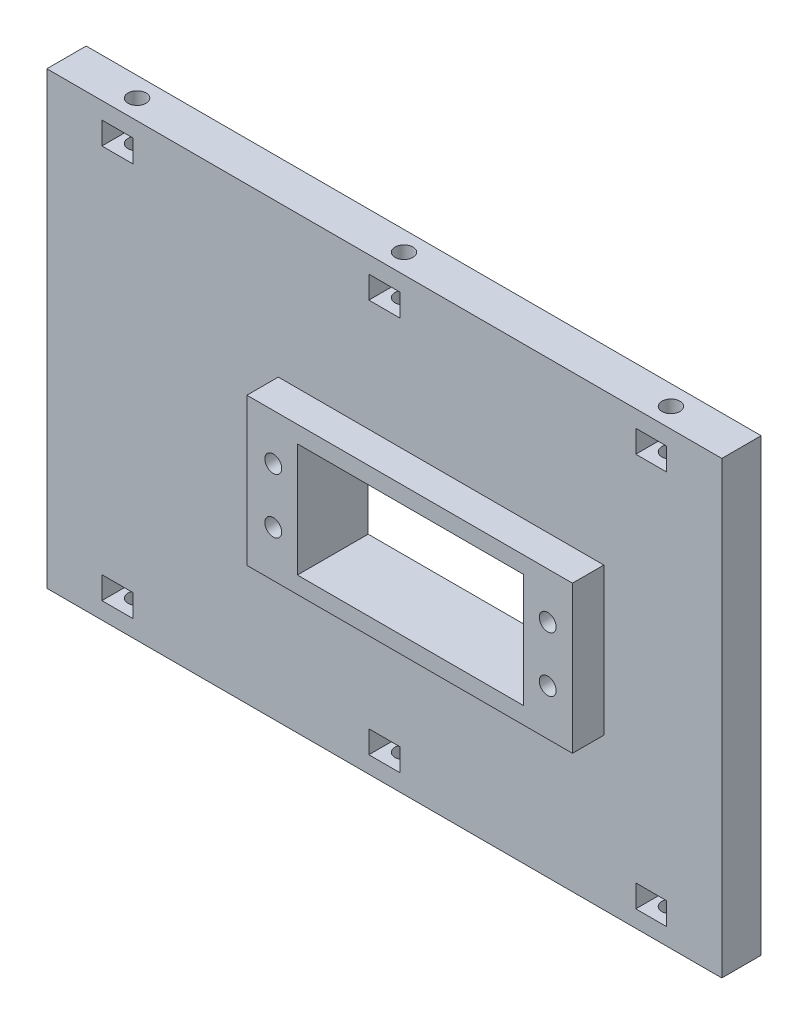
from build123d import *

# Parameters (mm, degrees)
ESBO_O1_W                = 120
ESBO_O1_H                = 80
ESBO_O1_R                = 1.501648648
ESBO_O1_W_2              = 40.2
ESBO_O1_H_2              = 20.2
ESBO_O1_W_3              = 5.5
ESBO_O1_H_3              = 4
RESSALTO_EXTRUS_O4_DEPTH = 7
RESSALTO_EXTRUS_O5_START = 7
ESBO_O1_12_W             = 57.88
ESBO_O1_12_H             = 26.2
ESBO_O1_12_R             = 1.501648648
ESBO_O1_12_W_2           = 40.2
ESBO_O1_12_H_2           = 20.2
RESSALTO_EXTRUS_O5_DEPTH = 5.58
ESBO_O9_R                = 1.6
CORTE_EXTRUS_O7_DEPTH    = 10
CORTE_EXTRUS_O8_START    = -10
ESBO_O10_R               = 1.6
CORTE_EXTRUS_O8_DEPTH    = 10


with BuildPart() as part:
    # Esboço1 → Ressalto-extrusão4 (new body)
    with BuildSketch(Plane.XY):
        Rectangle(ESBO_O1_W, ESBO_O1_H)
        with Locations((34.63, -4.9)):
            Circle(ESBO_O1_R, mode=Mode.SUBTRACT)
        with Locations((34.63, 4.9)):
            Circle(ESBO_O1_R, mode=Mode.SUBTRACT)
        with Locations((-14.17, -4.9)):
            Circle(ESBO_O1_R, mode=Mode.SUBTRACT)
        with Locations((-14.17, 4.9)):
            Circle(ESBO_O1_R, mode=Mode.SUBTRACT)
        with Locations((10.23, 0)):
            Rectangle(ESBO_O1_W_2, ESBO_O1_H_2, mode=Mode.SUBTRACT)
        with Locations((-47.46, -35)):
            Rectangle(ESBO_O1_W_3, ESBO_O1_H_3, mode=Mode.SUBTRACT)
        with Locations((47.46, -35)):
            Rectangle(ESBO_O1_W_3, ESBO_O1_H_3, mode=Mode.SUBTRACT)
        with Locations((0, -35)):
            Rectangle(ESBO_O1_W_3, ESBO_O1_H_3, mode=Mode.SUBTRACT)
        with Locations((47.46, 35)):
            Rectangle(ESBO_O1_W_3, ESBO_O1_H_3, mode=Mode.SUBTRACT)
        with Locations((0, 35)):
            Rectangle(ESBO_O1_W_3, ESBO_O1_H_3, mode=Mode.SUBTRACT)
        with Locations((-47.46, 35)):
            Rectangle(ESBO_O1_W_3, ESBO_O1_H_3, mode=Mode.SUBTRACT)
    extrude(amount=RESSALTO_EXTRUS_O4_DEPTH)

    # Esboço1<12> → Ressalto-extrusão5 (add)
    with BuildSketch(Plane.XY.offset(RESSALTO_EXTRUS_O5_START)):
        with Locations((10.09, 0)):
            Rectangle(ESBO_O1_12_W, ESBO_O1_12_H)
        with Locations(Location((-14.17, 4.9, 0), (0, 0, 180))):
            Circle(ESBO_O1_12_R, mode=Mode.SUBTRACT)
        with Locations(Location((34.63, 4.9, 0), (0, 0, 180))):
            Circle(ESBO_O1_12_R, mode=Mode.SUBTRACT)
        with Locations(Location((34.63, -4.9, 0), (0, 0, 180))):
            Circle(ESBO_O1_12_R, mode=Mode.SUBTRACT)
        with Locations(Location((-14.17, -4.9, 0), (0, 0, 180))):
            Circle(ESBO_O1_12_R, mode=Mode.SUBTRACT)
        with Locations((10.23, 0)):
            Rectangle(ESBO_O1_12_W_2, ESBO_O1_12_H_2, mode=Mode.SUBTRACT)
    extrude(amount=RESSALTO_EXTRUS_O5_DEPTH)

    # Esboço9 → Corte-extrusão7 (cut)
    with BuildSketch(Plane.XZ.offset(40)):
        with Locations(Location((-47.46, 3.5, 0), (0, 0, 270))):
            Circle(ESBO_O9_R)
        with Locations(Location((0, 3.5, 0), (0, 0, 270))):
            Circle(ESBO_O9_R)
        with Locations((47.46, 3.5)):
            Circle(ESBO_O9_R)
    extrude(amount=-CORTE_EXTRUS_O7_DEPTH, mode=Mode.SUBTRACT)

    # Esboço10 → Corte-extrusão8 (cut)
    with BuildSketch(Plane(origin=(0, 40, 0), x_dir=(1, 0, 0), z_dir=(0, 1, 0)).offset(CORTE_EXTRUS_O8_START)):
        with Locations(Location((-47.46, -3.5, 0), (0, 0, 90))):
            Circle(ESBO_O10_R)
        with Locations(Location((0, -3.5, 0), (0, 0, 90))):
            Circle(ESBO_O10_R)
        with Locations((47.46, -3.5)):
            Circle(ESBO_O10_R)
    extrude(amount=CORTE_EXTRUS_O8_DEPTH, mode=Mode.SUBTRACT)


solid = part.part
